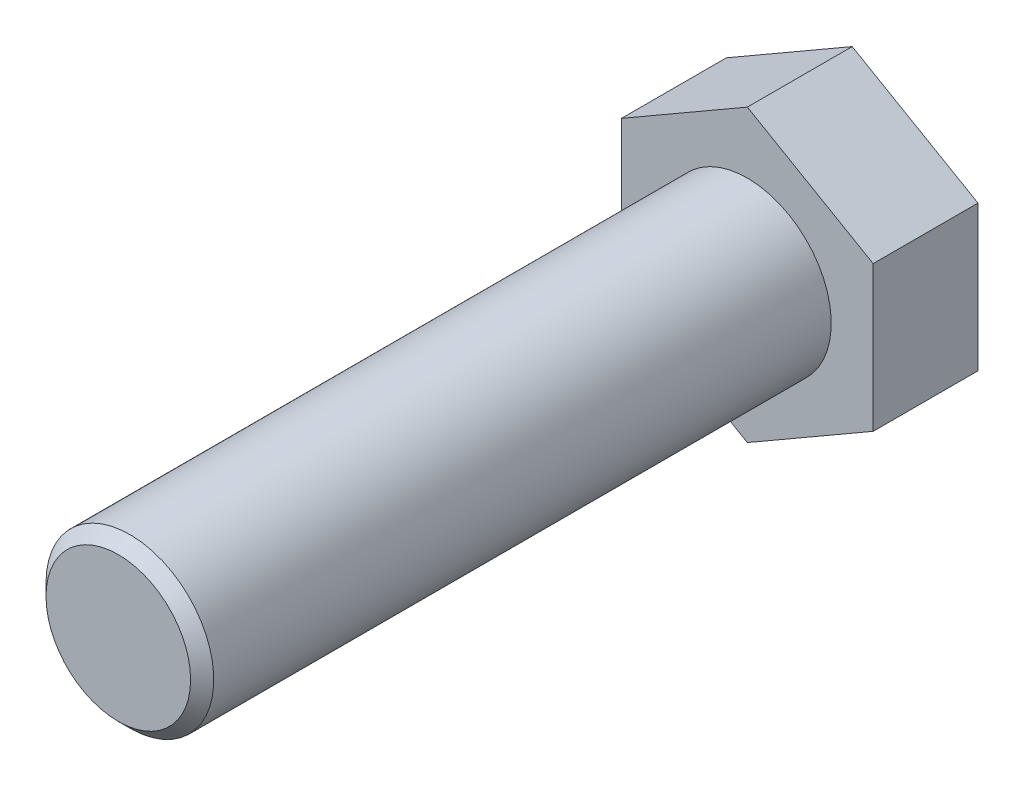
from build123d import *

# Parameters (mm, degrees)
EXTRUDE_1_DEPTH = 7.5
SKETCH_2_R      = 6
EXTRUDE_2_DEPTH = 45
CHAMFER_1_SIZE  = 0.828


with BuildPart() as part:
    # Эскиз1 → Бобышка-Вытянуть1 (new body)
    with BuildSketch(Plane.XY):
        Polygon((0, 10.392304845), (-9, 5.196152423), (-9, -5.196152423), (0, -10.392304845), (9, -5.196152423), (9, 5.196152423), align=None)
    extrude(amount=EXTRUDE_1_DEPTH)

    # Эскиз2 → Бобышка-Вытянуть2 (add)
    with BuildSketch(Plane.XY.offset(7.5)):
        with Locations(Location((0, 0, 0), (0, 0, 180))):
            Circle(SKETCH_2_R)
    extrude(amount=EXTRUDE_2_DEPTH)

    # Фаска1
    chamfer_1_edges = [part.edges().sort_by_distance(p)[0] for p in [
        (6, 0, 52.5),
    ]]
    chamfer(chamfer_1_edges, length=CHAMFER_1_SIZE)


solid = part.part
